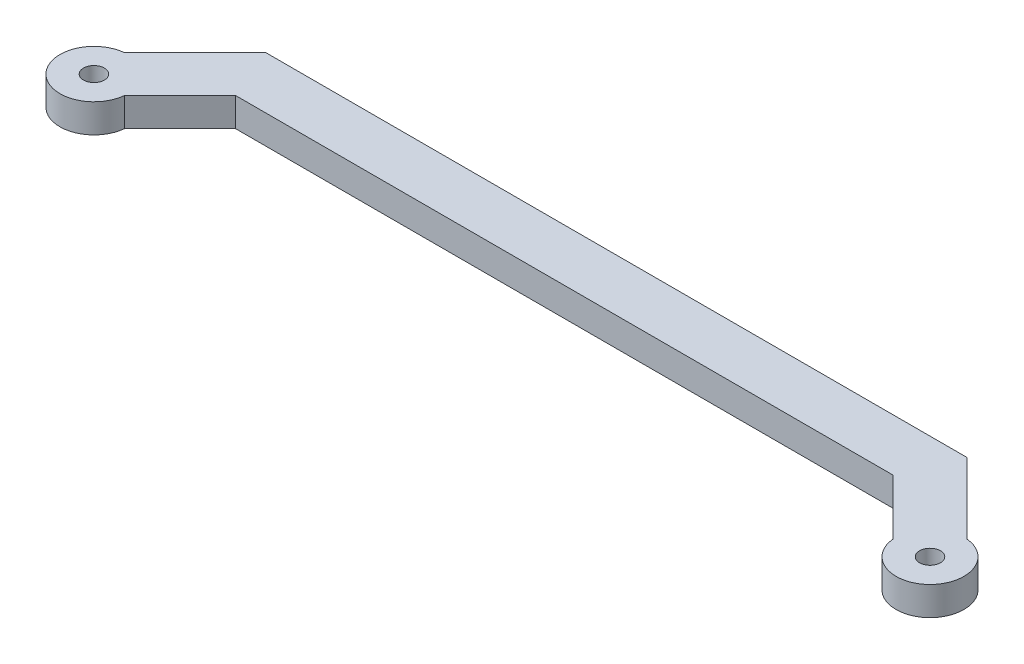
from build123d import *

# Parameters (mm, degrees)
SKETCH1_R           = 2
BOSS_EXTRUDE1_DEPTH = 5.5


with BuildPart() as part:
    # Sketch1 → Boss-Extrude1 (new body)
    with BuildSketch(Plane(origin=(0, 0, 0), x_dir=(1, 0, 0), z_dir=(0, 1, 0))):
        with BuildLine():
            Line((-62.928932188, 0), (62.928932188, 0))
            Line((62.928932188, 0), (73.527631063, -10.598698875))
            ThreePointArc((73.527631063, -10.598698875), (84.596194078, -14.596194078), (80.598698875, -3.527631063))
            Line((80.598698875, -3.527631063), (67.071067812, 10))
            Line((67.071067812, 10), (-67.071067812, 10))
            Line((-67.071067812, 10), (-80.598698875, -3.527631063))
            ThreePointArc((-80.598698875, -3.527631063), (-84.596194078, -14.596194078), (-73.527631063, -10.598698875))
            Line((-73.527631063, -10.598698875), (-62.928932188, 0))
        make_face()
        with Locations(Location((80, -10, 0), (0, 0, 270))):
            Circle(SKETCH1_R, mode=Mode.SUBTRACT)
        with Locations(Location((-80, -10, 0), (0, 0, 90))):
            Circle(SKETCH1_R, mode=Mode.SUBTRACT)
    extrude(amount=BOSS_EXTRUDE1_DEPTH)


solid = part.part
